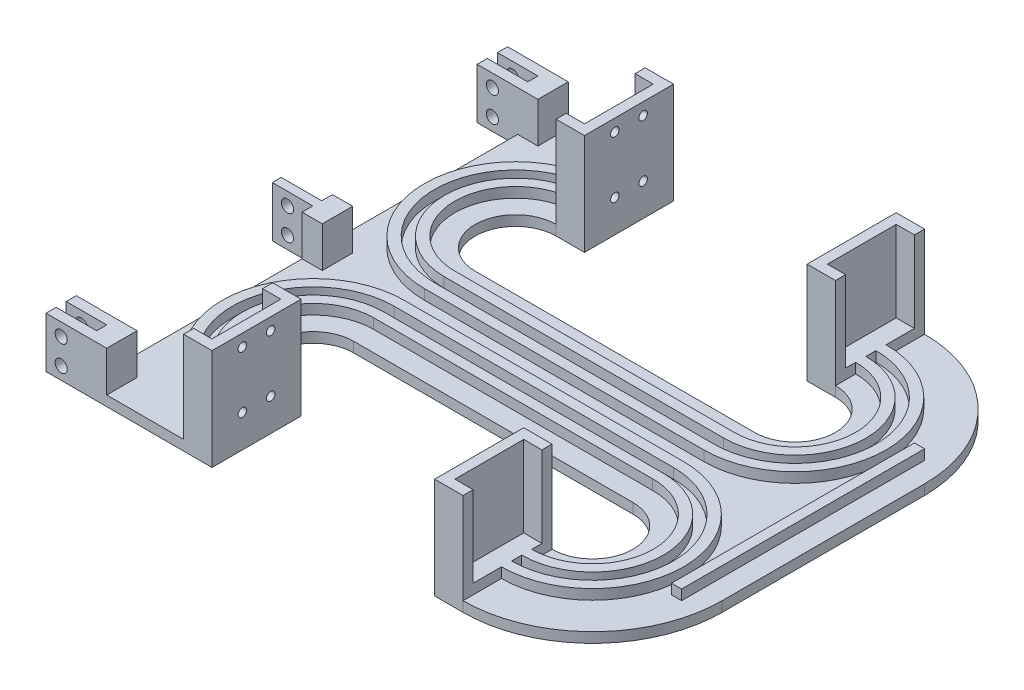
from build123d import *

# Parameters (mm, degrees)
BOSS_EXTRUDE1_DEPTH = 2.5
SKETCH3_W           = 2.5
SKETCH3_H           = 60
BOSS_EXTRUDE4_DEPTH = 2.5
BOSS_EXTRUDE5_DEPTH = 20
SKETCH7_R           = 3.75
BOSS_EXTRUDE6_DEPTH = 5.5
SKETCH9_R           = 3.75
BOSS_EXTRUDE7_DEPTH = 5.5
SKETCH10_R          = 1.05
CUT_EXTRUDE1_DEPTH  = 2.5
SKETCH12_R          = 1.05
CUT_EXTRUDE2_DEPTH  = 2.5
SKETCH14_W          = 5
SKETCH14_H          = 7.5
BOSS_EXTRUDE8_DEPTH = 10
SKETCH15_W          = 2.2
SKETCH15_H          = 12.5
SKETCH15_W_2        = 2.5
BOSS_EXTRUDE9_DEPTH = 10
SKETCH16_R          = 1.5
CUT_EXTRUDE3_DEPTH  = 114


with BuildPart() as part:
    # Sketch2 → Boss-Extrude1 (new body)
    with BuildSketch(Plane(origin=(0, 0, 0), x_dir=(1, 0, 0), z_dir=(0, 1, 0))):
        with BuildLine():
            Line((62.5, 25), (62.5, -25))
            ThreePointArc((62.5, -25), (53.127416998, -47.627416998), (30.5, -57))
            Line((30.5, -57), (23.5, -57))
            Line((23.5, -57), (23.5, -35))
            Line((23.5, -35), (30.5, -35))
            ThreePointArc((30.5, -35), (40.5, -25), (30.5, -15))
            Line((30.5, -15), (-38.5, -15))
            ThreePointArc((-38.5, -15), (-48.5, -25), (-38.5, -35))
            Line((-38.5, -35), (-31.5, -35))
            Line((-31.5, -35), (-31.5, -57))
            Line((-31.5, -57), (-38.5, -57))
            Line((-38.5, -57), (-62.5, -57))
            Line((-62.5, -57), (-62.5, 57))
            Line((-62.5, 57), (-38.5, 57))
            Line((-38.5, 57), (-31.5, 57))
            Line((-31.5, 57), (-31.5, 35))
            Line((-31.5, 35), (-38.5, 35))
            ThreePointArc((-38.5, 35), (-48.5, 25), (-38.5, 15))
            Line((-38.5, 15), (30.5, 15))
            ThreePointArc((30.5, 15), (40.5, 25), (30.5, 35))
            Line((30.5, 35), (23.5, 35))
            Line((23.5, 35), (23.5, 57))
            Line((23.5, 57), (30.5, 57))
            ThreePointArc((30.5, 57), (53.127416998, 47.627416998), (62.5, 25))
        make_face()
    extrude(amount=BOSS_EXTRUDE1_DEPTH)

    # Sketch3 → Boss-Extrude4 (add)
    # profile 1 of 3: a face of its own
    with BuildSketch(Plane(origin=(0, 2.5, 0), x_dir=(1, 0, 0), z_dir=(0, 1, 0))):
        with BuildLine():
            Line((30.5, -40.000579699), (30.5, -35))
            Line((30.5, -35), (23.5, -35))
            Line((23.5, -35), (23.5, -57))
            Line((23.5, -57), (30.5, -57))
            Line((30.5, -57), (30.5, -47.5))
            ThreePointArc((30.5, -47.5), (53, -25), (30.5, -2.5))
            Line((30.5, -2.5), (-38.5, -2.5))
            ThreePointArc((-38.5, -2.5), (-61, -25), (-38.5, -47.5))
            Line((-38.5, -47.5), (-38.5, -57))
            Line((-38.5, -57), (-31.5, -57))
            Line((-31.5, -57), (-31.5, -35))
            Line((-31.5, -35), (-38.5, -35))
            Line((-38.5, -35), (-38.5, -40.000579699))
            ThreePointArc((-38.5, -40.000579699), (-53.500434773, -25.065938667), (-38.631876061, -10))
            Line((-38.631876061, -10), (30.368123939, -10))
            ThreePointArc((30.368123939, -10), (45.500434773, -24.934061333), (30.5, -40.000579699))
        make_face()
        with BuildLine():
            Line((30.368123939, -7.5), (-38.631876061, -7.5))
            ThreePointArc((-38.631876061, -7.5), (-56.000372665, -25.065938498), (-38.5, -42.500496887))
            Line((-38.5, -42.500496887), (-38.5, -45))
            ThreePointArc((-38.5, -45), (-58.5, -25), (-38.5, -5))
            Line((-38.5, -5), (30.5, -5))
            ThreePointArc((30.5, -5), (50.5, -25), (30.5, -45))
            Line((30.5, -45), (30.5, -42.500496887))
            ThreePointArc((30.5, -42.500496887), (48.000372665, -24.934061502), (30.368123939, -7.5))
        make_face(mode=Mode.SUBTRACT)
    # profile 2 of 3: a face of its own
    with BuildSketch(Plane(origin=(0, 2.5, 0), x_dir=(1, 0, 0), z_dir=(0, 1, 0))):
        with BuildLine():
            Line((30.5, 57), (30.5, 47.5))
            ThreePointArc((30.5, 47.5), (53, 25), (30.5, 2.5))
            Line((30.5, 2.5), (-38.5, 2.5))
            ThreePointArc((-38.5, 2.5), (-61, 25), (-38.5, 47.5))
            Line((-38.5, 47.5), (-38.5, 57))
            Line((-38.5, 57), (-31.5, 57))
            Line((-31.5, 57), (-31.5, 35))
            Line((-31.5, 35), (-38.5, 35))
            Line((-38.5, 35), (-38.5, 40.000579699))
            ThreePointArc((-38.5, 40.000579699), (-53.500434773, 25.065938667), (-38.631876061, 10))
            Line((-38.631876061, 10), (30.368123939, 10))
            ThreePointArc((30.368123939, 10), (45.500434773, 24.934061333), (30.5, 40.000579699))
            Line((30.5, 40.000579699), (30.5, 35))
            Line((30.5, 35), (23.5, 35))
            Line((23.5, 35), (23.5, 57))
            Line((23.5, 57), (30.5, 57))
        make_face()
        with BuildLine():
            Line((30.5, 42.500496887), (30.5, 45))
            ThreePointArc((30.5, 45), (50.5, 25), (30.5, 5))
            Line((30.5, 5), (-38.5, 5))
            ThreePointArc((-38.5, 5), (-58.5, 25), (-38.5, 45))
            Line((-38.5, 45), (-38.5, 42.500496887))
            ThreePointArc((-38.5, 42.500496887), (-56.000372665, 25.065938498), (-38.631876061, 7.5))
            Line((-38.631876061, 7.5), (30.368123939, 7.5))
            ThreePointArc((30.368123939, 7.5), (48.000372665, 24.934061502), (30.5, 42.500496887))
        make_face(mode=Mode.SUBTRACT)
    # profile 3 of 3: a face of its own
    with BuildSketch(Plane(origin=(0, 2.5, 0), x_dir=(1, 0, 0), z_dir=(0, 1, 0))):
        with Locations((56.25, 0)):
            Rectangle(SKETCH3_W, SKETCH3_H)
    extrude(amount=BOSS_EXTRUDE4_DEPTH)

    # Sketch6 → Boss-Extrude5 (add)
    with BuildSketch(Plane(origin=(0, 5, 0), x_dir=(1, 0, 0), z_dir=(0, 1, 0))):
        Polygon((-38.5, -35), (-31.5, -35), (-31.5, -57), (-38.5, -57), (-38.5, -54.5), (-34, -54.5), (-34, -37.5), (-38.5, -37.5), align=None)
        Polygon((30.5, -35), (23.5, -35), (23.5, -57), (30.5, -57), (30.5, -54.5), (26, -54.5), (26, -37.5), (30.5, -37.5), align=None)
        Polygon((30.5, 37.5), (30.5, 35), (23.5, 35), (23.5, 57), (30.5, 57), (30.5, 54.5), (26, 54.5), (26, 37.5), align=None)
        Polygon((-38.5, 37.5), (-38.5, 35), (-31.5, 35), (-31.5, 57), (-38.5, 57), (-38.5, 54.5), (-34, 54.5), (-34, 37.5), align=None)
    extrude(amount=BOSS_EXTRUDE5_DEPTH)

    # Sketch7 → Boss-Extrude6 (add)
    with BuildSketch(Plane.ZY.offset(-23.5)):
        with Locations(Location((46, 13.75, 0), (0, 0, 180))):
            Circle(SKETCH7_R)
    extrude(amount=BOSS_EXTRUDE6_DEPTH)

    # Sketch9 → Boss-Extrude7 (add)
    with BuildSketch(Plane.ZY.offset(-23.5)):
        with Locations(Location((-46, 13.75, 0), (0, 0, 180))):
            Circle(SKETCH9_R)
    extrude(amount=BOSS_EXTRUDE7_DEPTH)

    # Sketch10 → Cut-Extrude1 (cut)
    with BuildSketch(Plane(origin=(-31.5, 0, 0), x_dir=(0, 0, -1), z_dir=(1, 0, 0))):
        with Locations((-42.5, 22)):
            Circle(SKETCH10_R)
        with Locations(Location((-49.5, 22, 0), (0, 0, 180))):
            Circle(SKETCH10_R)
        with Locations((-49.5, 8)):
            Circle(SKETCH10_R)
        with Locations(Location((-42.5, 8, 0), (0, 0, 180))):
            Circle(SKETCH10_R)
    extrude(amount=-CUT_EXTRUDE1_DEPTH, mode=Mode.SUBTRACT)

    # Sketch12 → Cut-Extrude2 (cut)
    with BuildSketch(Plane(origin=(-31.5, 0, 0), x_dir=(0, 0, -1), z_dir=(1, 0, 0))):
        with Locations((49.5, 22)):
            Circle(SKETCH12_R)
        with Locations(Location((42.5, 22, 0), (0, 0, 180))):
            Circle(SKETCH12_R)
        with Locations((42.5, 8)):
            Circle(SKETCH12_R)
        with Locations(Location((49.5, 8, 0), (0, 0, 180))):
            Circle(SKETCH12_R)
    extrude(amount=-CUT_EXTRUDE2_DEPTH, mode=Mode.SUBTRACT)

    # Sketch14 → Boss-Extrude8 (add)
    with BuildSketch(Plane(origin=(0, 2.5, 0), x_dir=(1, 0, 0), z_dir=(0, 1, 0))):
        with Locations((-60, 0)):
            Rectangle(SKETCH14_W, SKETCH14_H)
        with Locations((-60, -53.25)):
            Rectangle(SKETCH14_W, SKETCH14_H)
        with Locations((-60, 53.25)):
            Rectangle(SKETCH14_W, SKETCH14_H)
    extrude(amount=BOSS_EXTRUDE8_DEPTH)

    # Sketch15 → Boss-Extrude9 (add)
    with BuildSketch(Plane.ZY.offset(62.5)):
        with Locations((0, 6.25)):
            Rectangle(SKETCH15_W, SKETCH15_H)
        with Locations((55.75, 6.25)):
            Rectangle(SKETCH15_W_2, SKETCH15_H)
        with Locations((50.75, 6.25)):
            Rectangle(SKETCH15_W_2, SKETCH15_H)
        with Locations((-50.75, 6.25)):
            Rectangle(SKETCH15_W_2, SKETCH15_H)
        with Locations((-55.75, 6.25)):
            Rectangle(SKETCH15_W_2, SKETCH15_H)
    extrude(amount=BOSS_EXTRUDE9_DEPTH)

    # Sketch16 → Cut-Extrude3 (cut)
    with BuildSketch(Plane.XY.offset(57)):
        with Locations((-68.75, 9.375)):
            Circle(SKETCH16_R)
        with Locations((-68.75, 3.125)):
            Circle(SKETCH16_R)
    extrude(amount=-CUT_EXTRUDE3_DEPTH, mode=Mode.SUBTRACT)


solid = part.part
